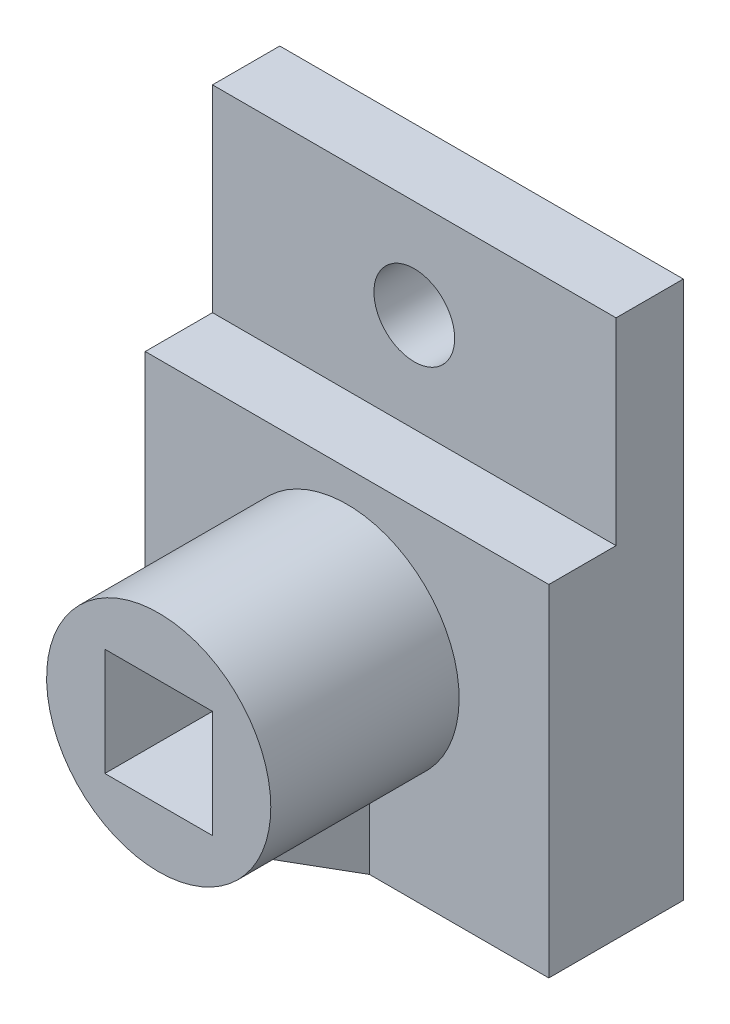
from build123d import *

# Parameters (mm, degrees)
SKETCH_1_W          = 45
SKETCH_1_H          = 60
EXTRUDE_1_DEPTH     = 15
SKETCH_2_W          = 7.5
SKETCH_2_H          = 22
CUT_EXTRUDE_1_DEPTH = 57.124860802
SKETCH_3_R          = 12.5
EXTRUDE_2_DEPTH     = 21
SKETCH_6_R          = 4.5
CUT_EXTRUDE_4_DEPTH = 48.100955404
RIB_1_REACH         = 53.983
SKETCH_7_WALL_W     = 123.721621612
SKETCH_7_WALL_H     = 5
SKETCH_8_W          = 12
SKETCH_8_H          = 12
CUT_EXTRUDE_5_DEPTH = 52.983170353


with BuildPart() as part:
    # Эскиз1 → Бобышка-Вытянуть1 (new body)
    with BuildSketch(Plane.XY):
        Rectangle(SKETCH_1_W, SKETCH_1_H)
    extrude(amount=EXTRUDE_1_DEPTH)

    # Эскиз2 → Вырез-Вытянуть1 (cut, through all)
    with BuildSketch(Plane(origin=(22.5, 0, 0), x_dir=(0, 0, -1), z_dir=(1, 0, 0))):
        with Locations((-11.25, 19)):
            Rectangle(SKETCH_2_W, SKETCH_2_H)
    extrude(amount=-CUT_EXTRUDE_1_DEPTH, mode=Mode.SUBTRACT)

    # Эскиз3 → Бобышка-Вытянуть2 (add)
    with BuildSketch(Plane.XY.offset(15)):
        with Locations(Location((0, -8, 0), (0, 0, 180))):
            Circle(SKETCH_3_R)
    extrude(amount=EXTRUDE_2_DEPTH)

    # Эскиз6 → Вырез-Вытянуть4 (cut, through all)
    with BuildSketch(Plane.XY.offset(7.5)):
        with Locations((0, 19)):
            Circle(SKETCH_6_R)
    extrude(amount=-CUT_EXTRUDE_4_DEPTH, mode=Mode.SUBTRACT)

    # Эскиз7 wall → Ребро1 (add, up to next)
    with BuildSketch(Plane(origin=(0, -25.25, 22.5), x_dir=(0, -0.535052081184, -0.844819075554), z_dir=(0, 0.844819075554, -0.535052081184)), mode=Mode.PRIVATE) as rib_1_sk1:
        Rectangle(SKETCH_7_WALL_W, SKETCH_7_WALL_H)
    rib_1_tool1 = extrude(rib_1_sk1.sketch, amount=RIB_1_REACH, mode=Mode.PRIVATE) - part.part
    add(rib_1_tool1.solids().sort_by_distance((0, -25.25, 22.5))[0])

    # Эскиз8 → Вырез-Вытянуть5 (cut, through all)
    with BuildSketch(Plane.XY.offset(36)):
        with Locations((0, -8)):
            Rectangle(SKETCH_8_W, SKETCH_8_H)
    extrude(amount=-CUT_EXTRUDE_5_DEPTH, mode=Mode.SUBTRACT)


solid = part.part
